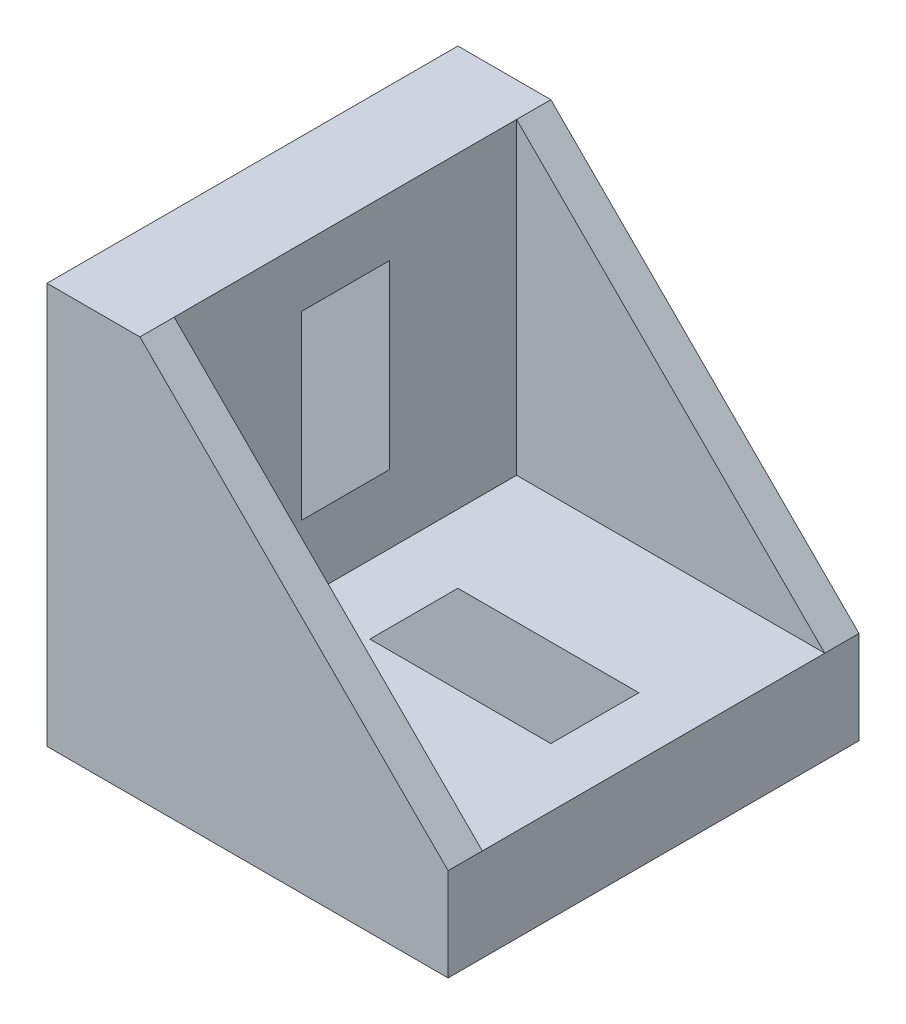
from build123d import *

# Parameters (mm, degrees)
BOSS_EXTRUDE1_DEPTH = 21
CUT_EXTRUDE1_DEPTH  = 17.5
CUT_EXTRUDE2_DEPTH  = 4.5
BOSS_EXTRUDE2_DEPTH = 5


with BuildPart() as part:
    # Sketch1 → Boss-Extrude1 (new, symmetric)
    with BuildSketch(Plane.XY):
        Polygon((0, 0), (0, 41), (9.5, 41), (41, 9.5), (41, 0), align=None)
    extrude(amount=BOSS_EXTRUDE1_DEPTH, both=True)

    # Sketch2 → Cut-Extrude1 (cut, symmetric)
    with BuildSketch(Plane.XY):
        Polygon((9.5, 41), (9.5, 9.5), (41, 9.5), align=None)
    extrude(amount=CUT_EXTRUDE1_DEPTH, both=True, mode=Mode.SUBTRACT)

    # Sketch3 → Cut-Extrude2 (cut, symmetric)
    with BuildSketch(Plane.XY):
        Polygon((0, 35), (9.5, 35), (9.5, 16.5), (0, 7), align=None)
        Polygon((16.5, 9.5), (35, 9.5), (35, 0), (7, 0), align=None)
    extrude(amount=CUT_EXTRUDE2_DEPTH, both=True, mode=Mode.SUBTRACT)

    # Sketch4 → Boss-Extrude2 (add, symmetric)
    with BuildSketch(Plane.XY):
        Polygon((-0.977707603, -4), (-1.72747232, -3.238363468), (1.234750477, 0), (3.535533906, 0), align=None)
        Polygon((0, 3.535533906), (-4, -0.977707603), (-3.238363468, -1.72747232), (0, 1.234750477), align=None)
        Polygon((0, 40.3), (0, 37.999216572), (-3.238363468, 35.036993774), (-4, 35.786758491), align=None)
        Polygon((37.999216572, 0), (35.036993774, -3.238363468), (35.786758491, -4), (40.3, 0), align=None)
    extrude(amount=BOSS_EXTRUDE2_DEPTH, both=True)


solid = part.part
